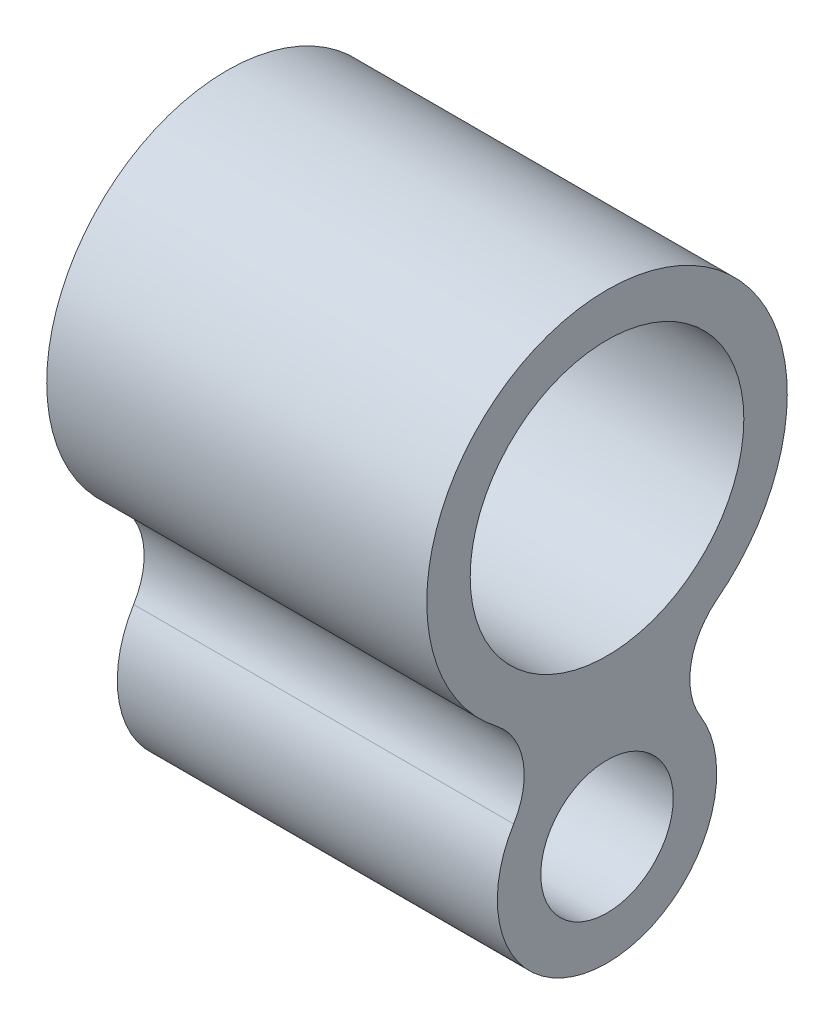
from build123d import *

# Parameters (mm, degrees)
SKETCH_1_R               = 12.6
SKETCH_1_R_2             = 6.1
EXTRUDE_1_DEPTH          = 35
CUT_EXTRUDE_1_DEPTH      = 54.637393673
CUT_EXTRUDE_1_DEPTH_BACK = 54.637393673


with BuildPart() as part:
    # 草图1 → 凸台-拉伸1 (new body)
    with BuildSketch(Plane(origin=(0, 0, 0), x_dir=(0, 0, -1), z_dir=(1, 0, 0))):
        with BuildLine():
            Line((-10.1, -27), (-10.1, -13.17383771))
            ThreePointArc((-10.1, -13.17383771), (0, 16.6), (10.1, -13.17383771))
            Line((10.1, -13.17383771), (10.1, -27))
            ThreePointArc((10.1, -27), (0, -37.1), (-10.1, -27))
        make_face()
        Circle(SKETCH_1_R, mode=Mode.SUBTRACT)
        with Locations((0, -27)):
            Circle(SKETCH_1_R_2, mode=Mode.SUBTRACT)
    extrude(amount=EXTRUDE_1_DEPTH)

    # 草图3 → 切除-拉伸1 (cut, two sides: drawn at the far end of the back side and taken through both)
    with BuildSketch(Plane(origin=(35, 0, 0), x_dir=(0, 0, -1), z_dir=(1, 0, 0)).offset(-CUT_EXTRUDE_1_DEPTH_BACK)):
        with BuildLine():
            Line((-16.628183068, -24.289618904), (-10.1, -27))
            ThreePointArc((-10.1, -27), (-9.71664565, -24.243771181), (-8.595683702, -21.696772521))
            ThreePointArc((-8.595683702, -21.696772521), (-16.131989791, -12.088249305), (-16.628183068, -24.289618904))
        make_face()
        with BuildLine():
            Line((10.1, -27), (14.395468751, -24.781680805))
            ThreePointArc((14.395468751, -24.781680805), (17.188775236, -12.535721906), (8.595683702, -21.696772521))
            ThreePointArc((8.595683702, -21.696772521), (9.71664565, -24.243771181), (10.1, -27))
        make_face()
    extrude(amount=CUT_EXTRUDE_1_DEPTH + CUT_EXTRUDE_1_DEPTH_BACK, mode=Mode.SUBTRACT)


solid = part.part
